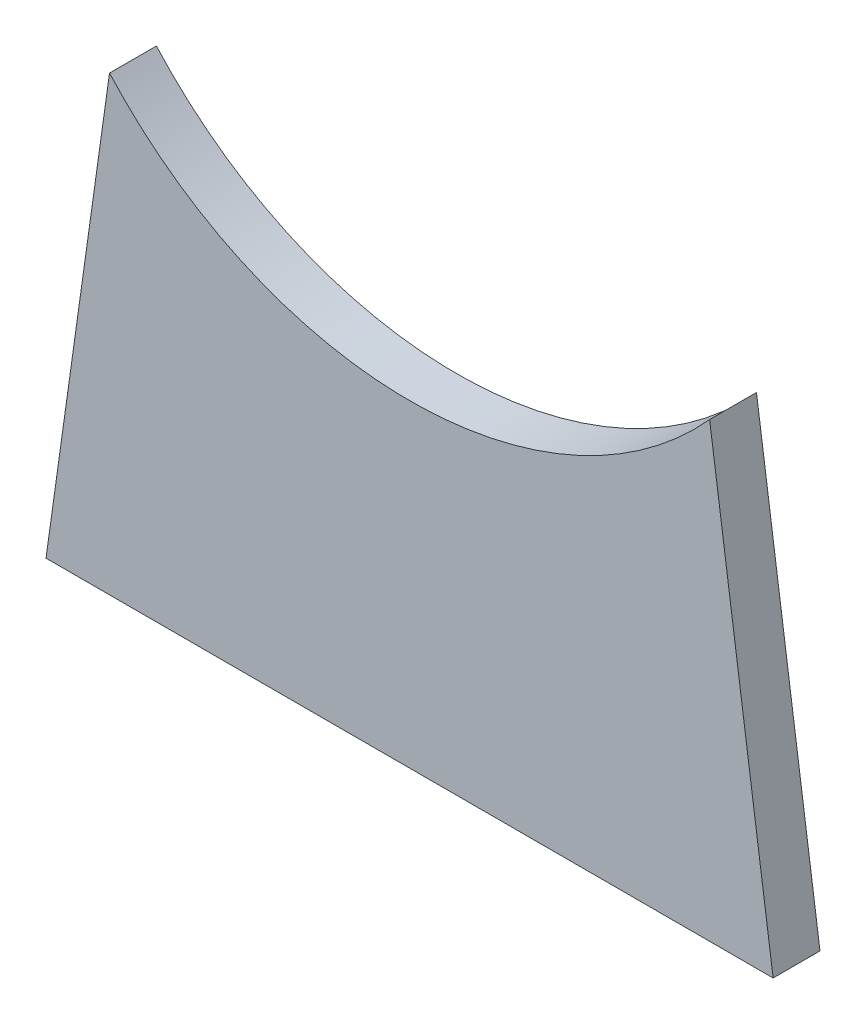
from build123d import *

# Parameters (mm, degrees)
BOSS_EXTRUDE1_DEPTH = 127.5


with BuildPart() as part:
    # Sketch1 → Boss-Extrude1 (new, symmetric)
    with BuildSketch(Plane.XY):
        with BuildLine():
            Line((-1978.1275, 0), (1978.1275, 0))
            Line((1978.1275, 0), (1632.572722675, 2458.75))
            ThreePointArc((1632.572722675, 2458.75), (0, 1731.474411249), (-1632.572722675, 2458.75))
            Line((-1632.572722675, 2458.75), (-1978.1275, 0))
        make_face()
    extrude(amount=BOSS_EXTRUDE1_DEPTH, both=True)


solid = part.part
